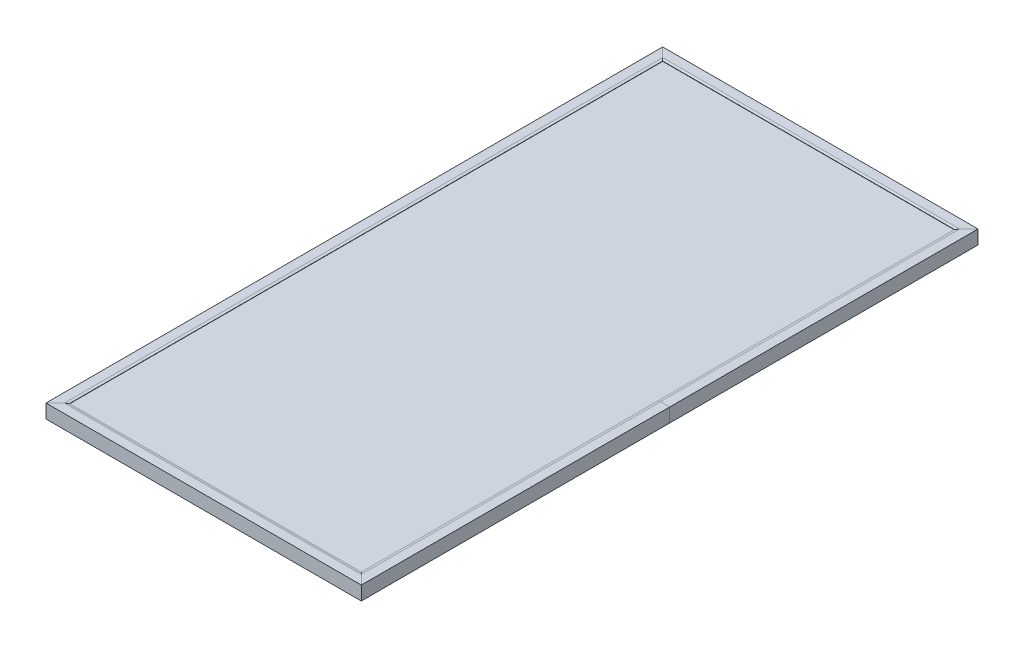
from build123d import *

# Parameters (mm, degrees)
SKETCH3_W                                 = 747.72
SKETCH3_H                                 = 1519.88
BOSS_EXTRUDE1_DEPTH                       = 3
BOSS_EXTRUDE2_DEPTH                       = 10
CUT_EXTRUDE1_DEPTH                        = 1.2
SKETCH8_R                                 = 4.5
EXTRA_CUT_HOLE_FOR_SIDE_PANEL_MOUNT_DEPTH = 1.2


with BuildPart() as part:
    # Sweep1: sweep along a path in Solar Panel Dimensions
    with BuildLine(Plane(origin=(0, 0, 0), x_dir=(1, 0, 0), z_dir=(0, 1, 0))) as sweep1_path:
        Line((-403.86, 789.94), (403.86, 789.94))
        Line((403.86, 789.94), (403.86, -789.94))
        Line((403.86, -789.94), (-403.86, -789.94))
        Line((-403.86, -789.94), (-403.86, 789.94))
    # Bracket → Sweep1 (sweep)
    with BuildSketch(Plane.XY):
        Polygon((403.86, 0), (373.86, 0), (373.86, 1.2), (399.86, 1.2), (399.86, 33.56), (373.86, 33.56), (373.86, 34.26412465), (380.294130539, 35.56), (403.86, 35.56), align=None)
    sweep(path=sweep1_path.line, transition=Transition.RIGHT)

    # Sketch5 → Cut-Extrude1 (cut)
    with BuildSketch(Plane(origin=(0, 0, 0), x_dir=(-1, 0, 0), z_dir=(0, -1, 0))):
        with BuildLine():
            Line((-379.86, 651.44), (-379.86, 646.44))
            ThreePointArc((-379.86, 646.44), (-384.36, 641.94), (-388.86, 646.44))
            Line((-388.86, 646.44), (-388.86, 651.44))
            ThreePointArc((-388.86, 651.44), (-384.36, 655.94), (-379.86, 651.44))
        make_face()
        with BuildLine():
            Line((-379.86, 401.44), (-379.86, 396.44))
            ThreePointArc((-379.86, 396.44), (-384.36, 391.94), (-388.86, 396.44))
            Line((-388.86, 396.44), (-388.86, 401.44))
            ThreePointArc((-388.86, 401.44), (-384.36, 405.94), (-379.86, 401.44))
        make_face()
        with BuildLine():
            Line((-379.86, -398.56), (-379.86, -403.56))
            ThreePointArc((-379.86, -403.56), (-384.36, -408.06), (-388.86, -403.56))
            Line((-388.86, -403.56), (-388.86, -398.56))
            ThreePointArc((-388.86, -398.56), (-384.36, -394.06), (-379.86, -398.56))
        make_face()
        with BuildLine():
            Line((-379.86, -648.56), (-379.86, -653.56))
            ThreePointArc((-379.86, -653.56), (-384.36, -658.06), (-388.86, -653.56))
            Line((-388.86, -653.56), (-388.86, -648.56))
            ThreePointArc((-388.86, -648.56), (-384.36, -644.06), (-379.86, -648.56))
        make_face()
        with BuildLine():
            Line((379.86, -648.56), (379.86, -653.56))
            ThreePointArc((379.86, -653.56), (384.36, -658.06), (388.86, -653.56))
            Line((388.86, -653.56), (388.86, -648.56))
            ThreePointArc((388.86, -648.56), (384.36, -644.06), (379.86, -648.56))
        make_face()
        with BuildLine():
            Line((379.86, 401.44), (379.86, 396.44))
            ThreePointArc((379.86, 396.44), (384.36, 391.94), (388.86, 396.44))
            Line((388.86, 396.44), (388.86, 401.44))
            ThreePointArc((388.86, 401.44), (384.36, 405.94), (379.86, 401.44))
        make_face()
        with BuildLine():
            Line((379.86, -398.56), (379.86, -403.56))
            ThreePointArc((379.86, -403.56), (384.36, -408.06), (388.86, -403.56))
            Line((388.86, -403.56), (388.86, -398.56))
            ThreePointArc((388.86, -398.56), (384.36, -394.06), (379.86, -398.56))
        make_face()
        with BuildLine():
            Line((379.86, 651.44), (379.86, 646.44))
            ThreePointArc((379.86, 646.44), (384.36, 641.94), (388.86, 646.44))
            Line((388.86, 646.44), (388.86, 651.44))
            ThreePointArc((388.86, 651.44), (384.36, 655.94), (379.86, 651.44))
        make_face()
    extrude(amount=-CUT_EXTRUDE1_DEPTH, mode=Mode.SUBTRACT)

    # Sketch8 → extra cut hole for side panel mount (cut)
    with BuildSketch(Plane.XZ):
        with Locations(Location((-384.36, 228.6, 0), (0, 0, 270))):
            Circle(SKETCH8_R)
        with Locations(Location((-384.36, -228.6, 0), (0, 0, 270))):
            Circle(SKETCH8_R)
        with Locations(Location((384.36, 228.6, 0), (0, 0, 90))):
            Circle(SKETCH8_R)
        with Locations(Location((384.36, -228.6, 0), (0, 0, 90))):
            Circle(SKETCH8_R)
    extrude(amount=-EXTRA_CUT_HOLE_FOR_SIDE_PANEL_MOUNT_DEPTH, mode=Mode.SUBTRACT)


with BuildPart() as body_2:
    # Sketch3 → Boss-Extrude1 (new body)
    with BuildSketch(Plane.XZ.offset(-33.56)):
        Rectangle(SKETCH3_W, SKETCH3_H)
    extrude(amount=BOSS_EXTRUDE1_DEPTH)

    # Sketch4 → Boss-Extrude2 (add)
    with BuildSketch(Plane.XZ.offset(-30.56)):
        Polygon((55, -659.94), (-55, -659.94), (-55, -584.94), (-20, -584.94), (-20, -604.94), (20, -604.94), (20, -584.94), (55, -584.94), align=None)
    extrude(amount=BOSS_EXTRUDE2_DEPTH)


solid = Compound([part.part, body_2.part])
